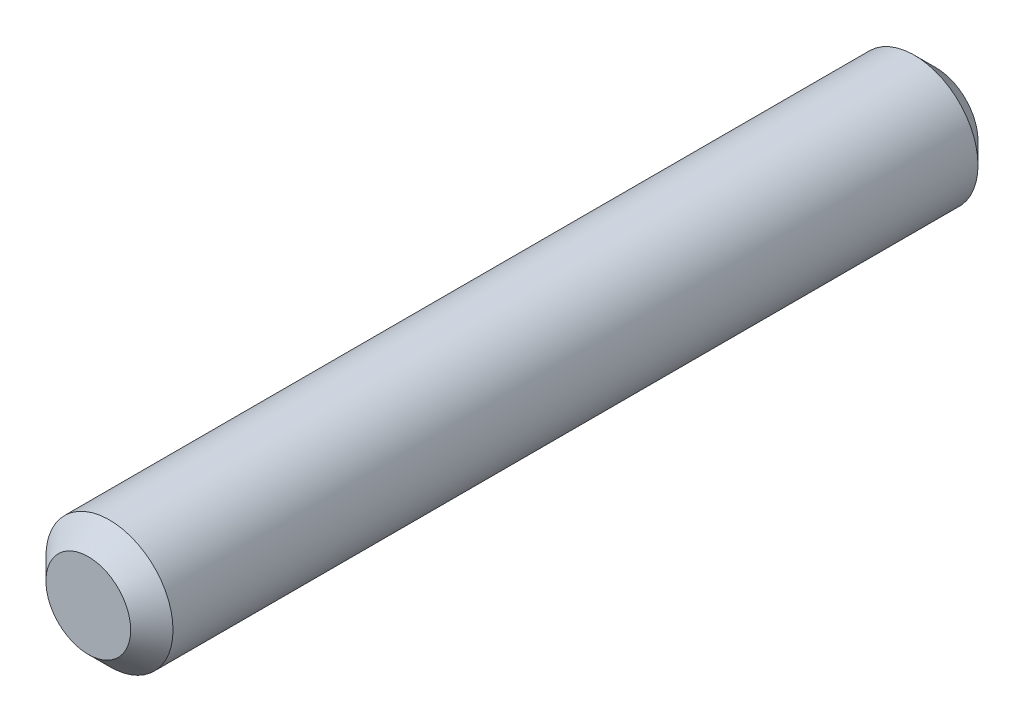
from build123d import *

# Parameters (mm, degrees)
SKETCH_1_R      = 1.5
EXTRUDE_1_DEPTH = 20
CHAMFER_1_SIZE  = 0.5


with BuildPart() as part:
    # Эскиз1 → Бобышка-Вытянуть1 (new body)
    with BuildSketch(Plane.XY):
        Circle(SKETCH_1_R)
    extrude(amount=EXTRUDE_1_DEPTH)

    # Фаска1
    chamfer_1_edges = [part.edges().sort_by_distance(p)[0] for p in [
        (-1.5, 0, 0),
        (-1.5, 0, 20),
    ]]
    chamfer(chamfer_1_edges, length=CHAMFER_1_SIZE)


solid = part.part
